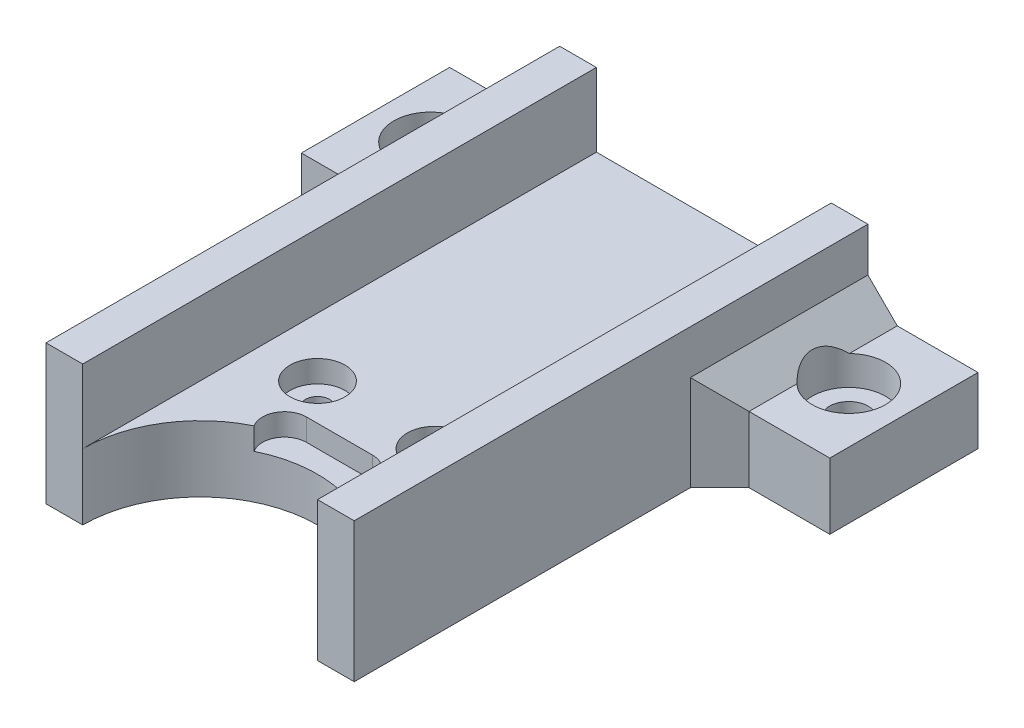
from build123d import *

# Parameters (mm, degrees)
SKETCH1_R               = 2.65
BOSS_EXTRUDE1_DEPTH     = 9
SKETCH2_W               = 5
SKETCH2_H               = 70
BOSS_EXTRUDE2_DEPTH     = 10
SKETCH3_R               = 1.65
CUT_EXTRUDE1_DEPTH      = 10
SKETCH4_R               = 3.75
CUT_EXTRUDE2_DEPTH      = 3
CUT_EXTRUDE3_DEPTH      = 3
CHAMFER1_SIZE           = 4
CUT_EXTRUDE4_DEPTH      = 5
CUT_EXTRUDE4_DEPTH_BACK = 4
SKETCH6_R               = 5


with BuildPart() as part:
    # Sketch1 → Boss-Extrude1 (new body)
    with BuildSketch(Plane(origin=(0, 0, 0), x_dir=(1, 0, 0), z_dir=(0, 1, 0))):
        with BuildLine():
            Line((57, 70), (57, 49.8))
            Line((57, 49.8), (42, 49.8))
            Line((42, 49.8), (42, 0))
            Line((42, 0), (37, 0))
            ThreePointArc((37, 0), (21, 16), (5, 0))
            Line((5, 0), (0, 0))
            Line((0, 0), (0, 49.8))
            Line((0, 49.8), (-15, 49.8))
            Line((-15, 49.8), (-15, 70))
            Line((-15, 70), (0, 70))
            Line((0, 70), (57, 70))
        make_face()
        with Locations(Location((-7.5, 59.9, 0), (0, 0, 270))):
            Circle(SKETCH1_R, mode=Mode.SUBTRACT)
        with Locations(Location((49.5, 59.9, 0), (0, 0, 270))):
            Circle(SKETCH1_R, mode=Mode.SUBTRACT)
    extrude(amount=BOSS_EXTRUDE1_DEPTH)

    # Sketch2 → Boss-Extrude2 (add)
    with BuildSketch(Plane(origin=(0, 9, 0), x_dir=(1, 0, 0), z_dir=(0, 1, 0))):
        with Locations((2.5, 35)):
            Rectangle(SKETCH2_W, SKETCH2_H)
        with Locations((39.5, 35)):
            Rectangle(SKETCH2_W, SKETCH2_H)
    extrude(amount=BOSS_EXTRUDE2_DEPTH)

    # Sketch3 → Cut-Extrude1 (cut)
    with BuildSketch(Plane.XZ):
        with Locations(Location((13, -24, 0), (0, 0, 270))):
            Circle(SKETCH3_R)
        with Locations(Location((29, -24, 0), (0, 0, 270))):
            Circle(SKETCH3_R)
    extrude(amount=-CUT_EXTRUDE1_DEPTH, mode=Mode.SUBTRACT)

    # Sketch4 → Cut-Extrude2 (cut)
    with BuildSketch(Plane(origin=(0, 9, 0), x_dir=(1, 0, 0), z_dir=(0, 1, 0))):
        with Locations(Location((13, 24, 0), (0, 0, 270))):
            Circle(SKETCH4_R)
        with Locations(Location((29, 24, 0), (0, 0, 270))):
            Circle(SKETCH4_R)
    extrude(amount=-CUT_EXTRUDE2_DEPTH, mode=Mode.SUBTRACT)

    # Sketch5 → Cut-Extrude3 (cut)
    with BuildSketch(Plane(origin=(0, 9, 0), x_dir=(1, 0, 0), z_dir=(0, 1, 0))):
        with BuildLine():
            Line((16.5, 19), (25.5, 19))
            ThreePointArc((25.5, 19), (28.5, 16), (25.5, 13))
            Line((25.5, 13), (16.5, 13))
            ThreePointArc((16.5, 13), (13.5, 16), (16.5, 19))
        make_face()
    extrude(amount=-CUT_EXTRUDE3_DEPTH, mode=Mode.SUBTRACT)

    # Chamfer1
    chamfer1_edges = [part.edges().sort_by_distance(p)[0] for p in [
        (42, 4.5, -49.8),
        (0, 4.5, -49.8),
        (0, 9, -59.9),
        (42, 9, -59.9),
    ]]
    chamfer(chamfer1_edges, length=CHAMFER1_SIZE)

    # Sketch6 → Cut-Extrude4 (cut, two sides: drawn at the far end of the back side and taken through both)
    with BuildSketch(Plane(origin=(0, 9, 0), x_dir=(1, 0, 0), z_dir=(0, 1, 0)).offset(-CUT_EXTRUDE4_DEPTH_BACK)):
        with Locations(Location((-7.5, 59.9, 0), (0, 0, 45.572995999))):
            Circle(SKETCH6_R)
        with Locations(Location((49.5, 59.9, 0), (0, 0, 134.427004001))):
            Circle(SKETCH6_R)
    extrude(amount=CUT_EXTRUDE4_DEPTH + CUT_EXTRUDE4_DEPTH_BACK, mode=Mode.SUBTRACT)


solid = part.part
